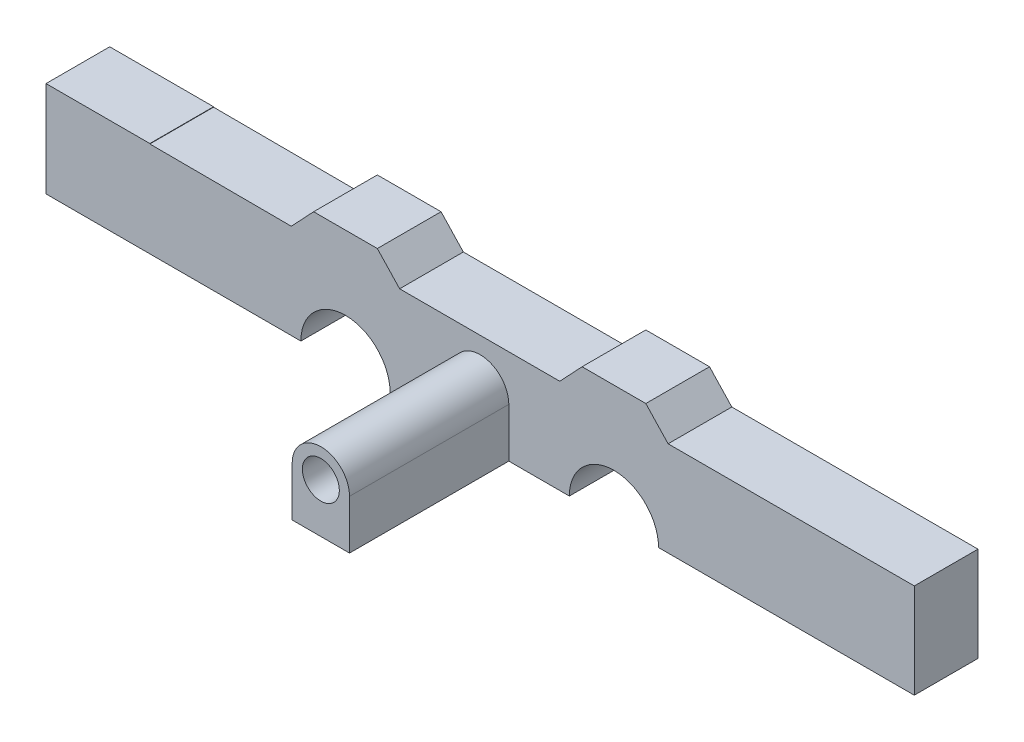
from build123d import *

# Parameters (mm, degrees)
BOSS_EXTRUDE1_DEPTH = 10
BOSS_EXTRUDE2_START = -2
BOSS_EXTRUDE2_DEPTH = 2
BOSS_EXTRUDE3_DEPTH = 2
SKETCH6_R           = 4.5
SKETCH6_R_2         = 2.9
BOSS_EXTRUDE4_DEPTH = 25
CUT_EXTRUDE1_START  = -8
SKETCH7_R           = 2.9
CUT_EXTRUDE1_DEPTH  = 8
SKETCH9_R           = 2.5
BOSS_EXTRUDE5_DEPTH = 10
BOSS_EXTRUDE6_START = -25
BOSS_EXTRUDE6_DEPTH = 25
SKETCH13_W          = 16.297841409
SKETCH13_H          = 10
BOSS_EXTRUDE7_DEPTH = 15
SKETCH14_W          = 6
SKETCH14_H          = 4.2
CUT_EXTRUDE4_DEPTH  = 8
SKETCH17_W          = 10
SKETCH17_H          = 0.143122073
CUT_EXTRUDE5_DEPTH  = 16.297841409
SKETCH18_R          = 3
CUT_EXTRUDE6_DEPTH  = 3


with BuildPart() as part:
    # Sketch1 → Boss-Extrude1 (new body)
    with BuildSketch(Plane.XY):
        with BuildLine():
            Line((0, 0), (0, 15))
            Line((0, 15), (38.500664221, 14.856877927))
            Line((38.500664221, 14.856877927), (42, 18.580686342))
            Line((42, 18.580686342), (47, 18.580686342))
            Line((47, 18.580686342), (52, 18.580686342))
            Line((52, 18.580686342), (55.499335779, 14.856877927))
            Line((55.499335779, 14.856877927), (80.635168579, 14.856877927))
            Line((80.635168579, 14.856877927), (84.134504358, 18.580686342))
            Line((84.134504358, 18.580686342), (89.134504358, 18.580686342))
            Line((89.134504358, 18.580686342), (94.134504358, 18.580686342))
            Line((94.134504358, 18.580686342), (97.633840137, 14.856877927))
            Line((97.633840137, 14.856877927), (136.134504358, 14.856877927))
            Line((136.134504358, 14.856877927), (136.134504358, 0))
            Line((136.134504358, 0), (96.134504358, 0))
            ThreePointArc((96.134504358, 0), (89.134504358, 7), (82.134504358, 0))
            Line((82.134504358, 0), (54, 0))
            ThreePointArc((54, 0), (47, 7), (40, 0))
            Line((40, 0), (0, 0))
        make_face()
        with BuildLine():
            Line((81.500231462, 12.856877927), (54.634272896, 12.856877927))
            Line((54.634272896, 12.856877927), (51.134937117, 16.580686342))
            Line((51.134937117, 16.580686342), (47, 16.580686342))
            Line((47, 16.580686342), (42.865062883, 16.580686342))
            Line((42.865062883, 16.580686342), (39.365727104, 12.856877927))
            Line((39.365727104, 12.856877927), (2, 12.856877927))
            Line((2, 12.856877927), (2, 2))
            Line((2, 2), (38.225035613, 2))
            ThreePointArc((38.225035613, 2), (47, 9), (55.774964387, 2))
            Line((55.774964387, 2), (80.35953997, 2))
            ThreePointArc((80.35953997, 2), (89.134504358, 9), (97.909468745, 2))
            Line((97.909468745, 2), (134.134504358, 2))
            Line((134.134504358, 2), (134.134504358, 12.856877927))
            Line((134.134504358, 12.856877927), (96.768777254, 12.856877927))
            Line((96.768777254, 12.856877927), (93.269441475, 16.580686342))
            Line((93.269441475, 16.580686342), (89.134504358, 16.580686342))
            Line((89.134504358, 16.580686342), (84.999567241, 16.580686342))
            Line((84.999567241, 16.580686342), (81.500231462, 12.856877927))
        make_face(mode=Mode.SUBTRACT)
    extrude(amount=BOSS_EXTRUDE1_DEPTH)

    # Sketch2 → Boss-Extrude2 (add)
    with BuildSketch(Plane.XY.offset(10).offset(BOSS_EXTRUDE2_START)):
        with BuildLine():
            Line((136.134504358, 0), (136.134504358, 14.856877927))
            Line((136.134504358, 14.856877927), (97.633840137, 14.856877927))
            Line((97.633840137, 14.856877927), (94.134504358, 18.580686342))
            Line((94.134504358, 18.580686342), (84.134504358, 18.580686342))
            Line((84.134504358, 18.580686342), (80.635168579, 14.856877927))
            Line((80.635168579, 14.856877927), (55.499335779, 14.856877927))
            Line((55.499335779, 14.856877927), (52, 18.580686342))
            Line((52, 18.580686342), (42, 18.580686342))
            Line((42, 18.580686342), (38.500664221, 14.856877927))
            Line((38.500664221, 14.856877927), (0, 15))
            Line((0, 15), (0, 0))
            Line((0, 0), (40, 0))
            ThreePointArc((40, 0), (47, 7), (54, 0))
            Line((54, 0), (82.134504358, 0))
            ThreePointArc((82.134504358, 0), (89.134504358, 7), (96.134504358, 0))
            Line((96.134504358, 0), (136.134504358, 0))
        make_face()
    extrude(amount=BOSS_EXTRUDE2_DEPTH)

    # Sketch3 → Boss-Extrude3 (add)
    with BuildSketch(Plane(origin=(0, 0, 0), x_dir=(-1, 0, 0), z_dir=(0, 0, -1))):
        with BuildLine():
            Line((0, 15), (-38.500664221, 14.856877927))
            Line((-38.500664221, 14.856877927), (-42, 18.580686342))
            Line((-42, 18.580686342), (-52, 18.580686342))
            Line((-52, 18.580686342), (-55.499335779, 14.856877927))
            Line((-55.499335779, 14.856877927), (-80.635168579, 14.856877927))
            Line((-80.635168579, 14.856877927), (-84.134504358, 18.580686342))
            Line((-84.134504358, 18.580686342), (-94.134504358, 18.580686342))
            Line((-94.134504358, 18.580686342), (-97.633840137, 14.856877927))
            Line((-97.633840137, 14.856877927), (-136.134504358, 14.856877927))
            Line((-136.134504358, 14.856877927), (-136.134504358, 0))
            Line((-136.134504358, 0), (-96.134504358, 0))
            ThreePointArc((-96.134504358, 0), (-89.134504358, 7), (-82.134504358, 0))
            Line((-82.134504358, 0), (-54, 0))
            ThreePointArc((-54, 0), (-47, 7), (-40, 0))
            Line((-40, 0), (0, 0))
            Line((0, 0), (0, 15))
        make_face()
    extrude(amount=-BOSS_EXTRUDE3_DEPTH)

    # Sketch6 → Boss-Extrude4 (add)
    with BuildSketch(Plane.XY.offset(10)):
        with Locations(Location((68.134504358, 7.717300047, 0), (0, 0, 180))):
            Circle(SKETCH6_R)
        with Locations((68.134504358, 7.717300047)):
            Circle(SKETCH6_R_2, mode=Mode.SUBTRACT)
    extrude(amount=BOSS_EXTRUDE4_DEPTH)

    # Sketch7 → Cut-Extrude1 (cut)
    with BuildSketch(Plane.XY.offset(10).offset(CUT_EXTRUDE1_START)):
        with Locations((68.134504358, 7.717300047)):
            Circle(SKETCH7_R)
    extrude(amount=CUT_EXTRUDE1_DEPTH, mode=Mode.SUBTRACT)

    # Sketch9 → Boss-Extrude5 (add)
    with BuildSketch(Plane.XY.offset(10)):
        with Locations((126.134504358, 7.356877927)):
            Circle(SKETCH9_R)
        with Locations((103, 7.5)):
            Circle(SKETCH9_R)
        with Locations((80.134504358, 7.5)):
            Circle(SKETCH9_R)
        with Locations((10.134504358, 7.356877927)):
            Circle(SKETCH9_R)
        with Locations((33.269008716, 7.5)):
            Circle(SKETCH9_R)
        with Locations((56.134504358, 7.5)):
            Circle(SKETCH9_R)
    extrude(amount=-BOSS_EXTRUDE5_DEPTH)

    # Sketch10 → Boss-Extrude6 (add)
    with BuildSketch(Plane.XY.offset(35).offset(BOSS_EXTRUDE6_START)):
        with BuildLine():
            Line((63.634504358, 7.717300047), (63.634504358, 0))
            Line((63.634504358, 0), (72.634504358, 0))
            Line((72.634504358, 0), (72.634504358, 7.717300047))
            ThreePointArc((72.634504358, 7.717300047), (68.134504358, 3.217300047), (63.634504358, 7.717300047))
        make_face()
    extrude(amount=BOSS_EXTRUDE6_DEPTH)

    # Sketch13 → Boss-Extrude7 (add)
    with BuildSketch(Plane.XZ):
        with Locations((8.148920705, 5)):
            Rectangle(SKETCH13_W, SKETCH13_H)
        with Locations((128.120088012, 5)):
            Rectangle(SKETCH13_W, SKETCH13_H)
    extrude(amount=-BOSS_EXTRUDE7_DEPTH)

    # Sketch14 → Cut-Extrude4 (cut)
    with BuildSketch(Plane.XZ):
        with Locations((12, 5)):
            Rectangle(SKETCH14_W, SKETCH14_H)
        with Locations((124.269008716, 5)):
            Rectangle(SKETCH14_W, SKETCH14_H)
    extrude(amount=-CUT_EXTRUDE4_DEPTH, mode=Mode.SUBTRACT)

    # Sketch17 → Cut-Extrude5 (cut)
    with BuildSketch(Plane.ZY.offset(-119.971167307)):
        with Locations((5, 14.928438964)):
            Rectangle(SKETCH17_W, SKETCH17_H)
    extrude(amount=-CUT_EXTRUDE5_DEPTH, mode=Mode.SUBTRACT)

    # Sketch18 → Cut-Extrude6 (cut)
    with BuildSketch(Plane(origin=(0, 0, 0), x_dir=(-1, 0, 0), z_dir=(0, 0, -1))):
        with Locations((-116.201756537, 7.428438964)):
            Circle(SKETCH18_R)
        with Locations((-19.932747821, 7.428438964)):
            Circle(SKETCH18_R)
    extrude(amount=-CUT_EXTRUDE6_DEPTH, mode=Mode.SUBTRACT)


solid = part.part
